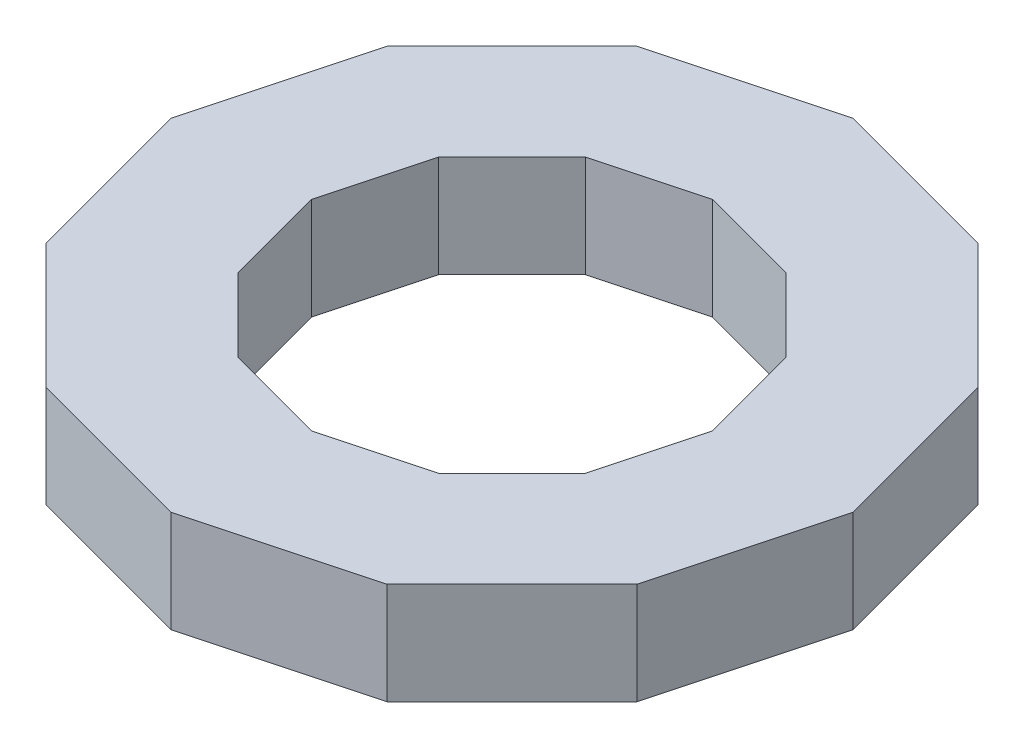
from build123d import *

# Parameters (mm, degrees)
BOSS_EXTRUDE1_DEPTH = 19.05


with BuildPart() as part:
    # Sketch1 → Boss-Extrude1 (new body)
    with BuildSketch(Plane(origin=(0, 0, 0), x_dir=(1, 0, 0), z_dir=(0, 1, 0))):
        Polygon((63.789741568, 0), (55.243536699, 31.894870784), (31.894870784, 55.243536699), (0, 63.789741568), (-31.894870784, 55.243536699), (-55.243536699, 31.894870784), (-63.789741568, 0), (-55.243536699, -31.894870784), (-31.894870784, -55.243536699), (0, -63.789741568), (31.894870784, -55.243536699), (55.243536699, -31.894870784), align=None)
        Polygon((37.493726586, 0), (32.470519706, 18.746863293), (18.746863293, 32.470519706), (0, 37.493726586), (-18.746863293, 32.470519706), (-32.470519706, 18.746863293), (-37.493726586, 0), (-32.470519706, -18.746863293), (-18.746863293, -32.470519706), (0, -37.493726586), (18.746863293, -32.470519706), (32.470519706, -18.746863293), align=None, mode=Mode.SUBTRACT)
    extrude(amount=BOSS_EXTRUDE1_DEPTH)


solid = part.part
